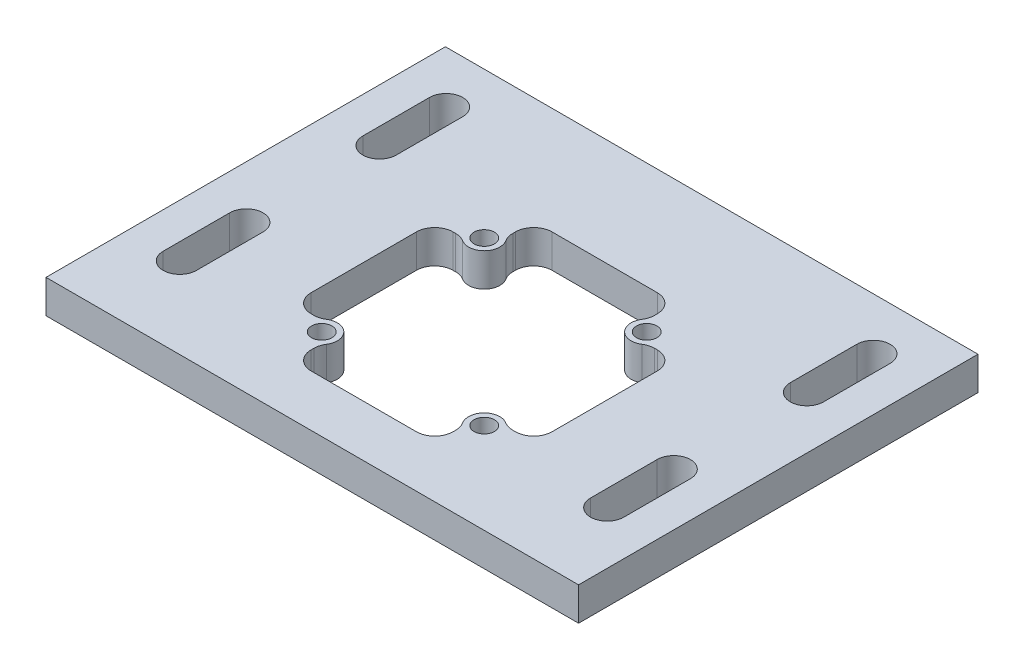
from build123d import *

# Parameters (mm, degrees)
SKETCH1_W              = 101.6
SKETCH1_H              = 76.2
BOSS_EXTRUDE1_DEPTH    = 3.175
M3_5_CLEARANCE_HOLE1_D = 3.9
CUT_EXTRUDE6_DEPTH     = 64.816710194
CUT_EXTRUDE7_DEPTH     = 64.816710194
CIRPATTERN1_COUNT      = 4
CUT_EXTRUDE8_DEPTH     = 64.816710194


with BuildPart() as part:
    # Sketch1 → Boss-Extrude1 (new, symmetric)
    with BuildSketch(Plane(origin=(0, 0, 0), x_dir=(1, 0, 0), z_dir=(0, 1, 0))):
        Rectangle(SKETCH1_W, SKETCH1_H)
    extrude(amount=BOSS_EXTRUDE1_DEPTH, both=True)

    # M3.5 Clearance Hole1 (through all)
    with Locations(Plane(origin=(0, 3.175, 0), x_dir=(1, 0, 0), z_dir=(0, 1, 0))):
        with Locations((-15.5, 10.2), (15.5, 10.2), (15.5, -20.8), (-15.5, -20.8)):
            Hole(M3_5_CLEARANCE_HOLE1_D / 2)

    # Sketch23 → Cut-Extrude6 (cut, through all)
    with BuildSketch(Plane(origin=(0, 3.175, 0), x_dir=(1, 0, 0), z_dir=(0, 1, 0))):
        with BuildLine():
            Line((-12.9860741, 15.72), (-12.9860741, 11.800180167))
            ThreePointArc((-12.9860741, 11.800180167), (-13.392821792, 8.092821792), (-17.100180167, 7.6860741))
            Line((-17.100180167, 7.6860741), (-21.02, 7.6860741))
            Line((-21.02, 7.6860741), (-21.02, -18.2860741))
            Line((-21.02, -18.2860741), (-17.100180167, -18.2860741))
            ThreePointArc((-17.100180167, -18.2860741), (-13.392821792, -18.692821792), (-12.9860741, -22.400180167))
            Line((-12.9860741, -22.400180167), (-12.9860741, -26.32))
            Line((-12.9860741, -26.32), (12.9860741, -26.32))
            Line((12.9860741, -26.32), (12.9860741, -22.400180167))
            ThreePointArc((12.9860741, -22.400180167), (13.392821792, -18.692821792), (17.100180167, -18.2860741))
            Line((17.100180167, -18.2860741), (21.02, -18.2860741))
            Line((21.02, -18.2860741), (21.02, 7.6860741))
            Line((21.02, 7.6860741), (17.100180167, 7.6860741))
            ThreePointArc((17.100180167, 7.6860741), (13.392821792, 8.092821792), (12.9860741, 11.800180167))
            Line((12.9860741, 11.800180167), (12.9860741, 15.72))
            Line((12.9860741, 15.72), (-12.9860741, 15.72))
        make_face()
    extrude(amount=-CUT_EXTRUDE6_DEPTH, mode=Mode.SUBTRACT)

    # Sketch24 → Cut-Extrude7 (cut, through all)
    with BuildSketch(Plane(origin=(0, 3.175, 0), x_dir=(1, 0, 0), z_dir=(0, 1, 0))):
        with BuildLine():
            Line((-18.979586404, 8.233476566), (-19.479586404, 8.233476566))
            ThreePointArc((-19.479586404, 8.233476566), (-21.954460139, 7.2083503), (-22.979586404, 4.733476566))
            Line((-22.979586404, 4.733476566), (-22.979586404, -15.333476566))
            ThreePointArc((-22.979586404, -15.333476566), (-21.954460139, -17.8083503), (-19.479586404, -18.833476566))
            Line((-19.479586404, -18.833476566), (-18.979586404, -18.833476566))
            ThreePointArc((-18.979586404, -18.833476566), (-18.000834998, -18.693840487), (-17.100180167, -18.2860741))
            ThreePointArc((-17.100180167, -18.2860741), (-13.392821792, -18.692821792), (-12.9860741, -22.400180167))
            Line((-12.9860741, -22.400180167), (-7.9860741, -22.400180167))
            Line((-7.9860741, -22.400180167), (-7.9860741, 11.800180167))
            Line((-7.9860741, 11.800180167), (-12.9860741, 11.800180167))
            ThreePointArc((-12.9860741, 11.800180167), (-13.392821792, 8.092821792), (-17.100180167, 7.6860741))
            ThreePointArc((-17.100180167, 7.6860741), (-18.000834998, 8.093840487), (-18.979586404, 8.233476566))
        make_face()
    cut_extrude7 = extrude(amount=-CUT_EXTRUDE7_DEPTH, mode=Mode.SUBTRACT)

    # CirPattern1: Cut-Extrude7 ×4 about axis
    cirpattern1_axis = Axis((0, 3.175, 5.3), (0, 1, 0))
    for i in range(1, CIRPATTERN1_COUNT):
        add(cut_extrude7.rotate(cirpattern1_axis, i * 360 / CIRPATTERN1_COUNT), mode=Mode.SUBTRACT)

    # Sketch25 → Cut-Extrude8 (cut, through all)
    with BuildSketch(Plane(origin=(0, 3.175, 0), x_dir=(1, 0, 0), z_dir=(0, 1, 0))):
        with BuildLine():
            Line((-43.942, 28.194), (-43.942, 15.494))
            ThreePointArc((-43.942, 15.494), (-40.767, 12.319), (-37.592, 15.494))
            Line((-37.592, 15.494), (-37.592, 28.194))
            ThreePointArc((-37.592, 28.194), (-40.767, 31.369), (-43.942, 28.194))
        make_face()
        with BuildLine():
            Line((-43.942, -9.906), (-43.942, -22.606))
            ThreePointArc((-43.942, -22.606), (-40.767, -25.781), (-37.592, -22.606))
            Line((-37.592, -22.606), (-37.592, -9.906))
            ThreePointArc((-37.592, -9.906), (-40.767, -6.731), (-43.942, -9.906))
        make_face()
    cut_extrude8 = extrude(amount=-CUT_EXTRUDE8_DEPTH, mode=Mode.SUBTRACT)

    # Mirror1: Cut-Extrude8 across plane
    add(cut_extrude8.mirror(Plane(origin=(0, 0, 0), x_dir=(0, 0, 1), z_dir=(1, 0, 0))), mode=Mode.SUBTRACT)


solid = part.part
